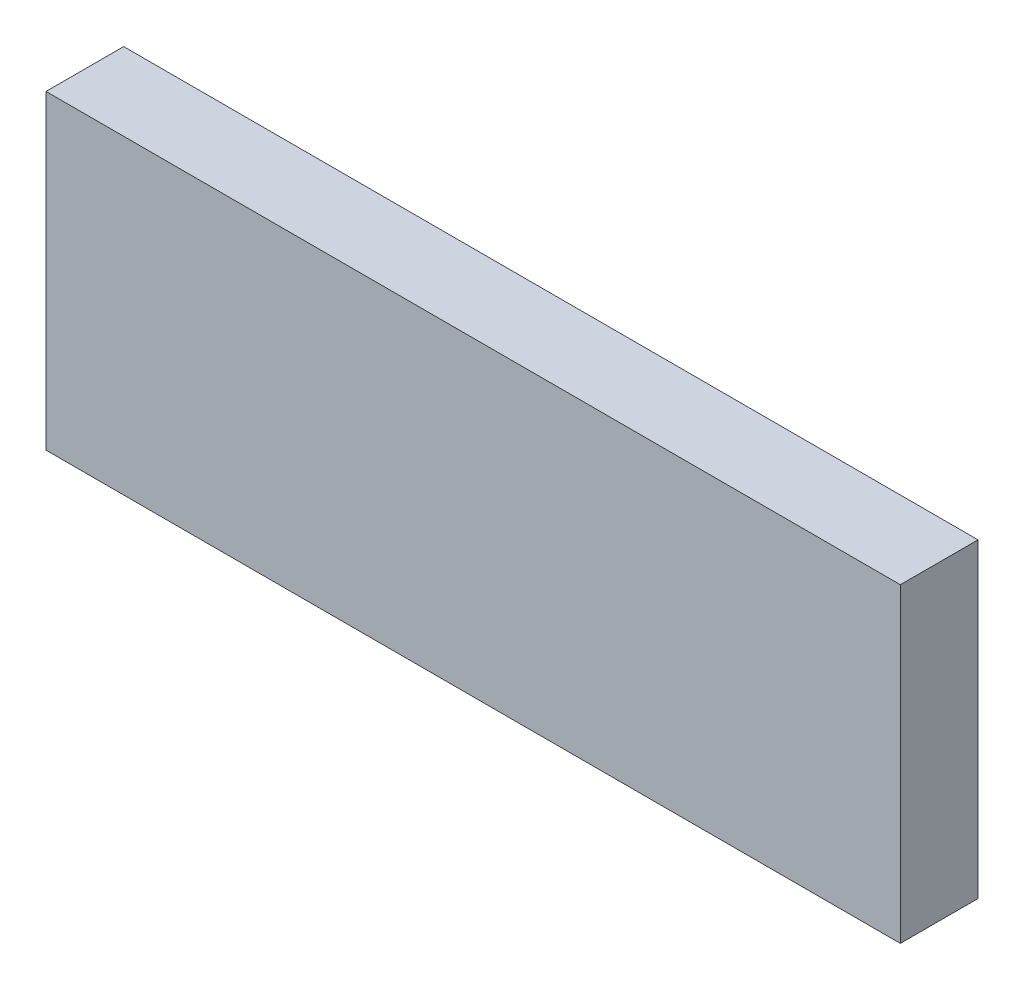
from build123d import *

# Parameters (mm, degrees)
SKETCH2_W           = 69.85
SKETCH2_H           = 25.4
BOSS_EXTRUDE1_DEPTH = 6.35


with BuildPart() as part:
    # Sketch2 → Boss-Extrude1 (new body)
    with BuildSketch(Plane.XY):
        with Locations((-11.105647482, 22.225)):
            Rectangle(SKETCH2_W, SKETCH2_H)
    extrude(amount=BOSS_EXTRUDE1_DEPTH)


solid = part.part
